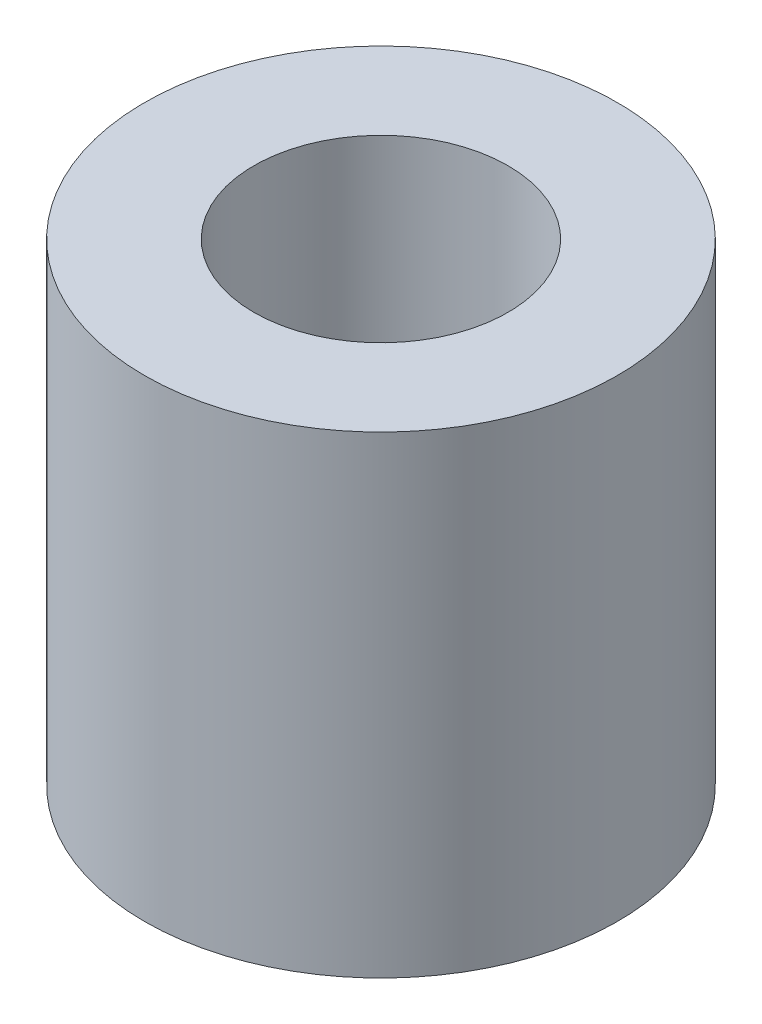
from build123d import *

# Parameters (mm, degrees)
TUBO_D8_START = -4
CROQUIS1_R    = 4
TUBO_D8_DEPTH = 8
PASO_M4_START = -4
CROQUIS2_R    = 2.15
PASO_M4_DEPTH = 8


with BuildPart() as part:
    # Croquis1 → Tubo_D8 (new body)
    with BuildSketch(Plane(origin=(0, 0, 0), x_dir=(1, 0, 0), z_dir=(0, 1, 0)).offset(TUBO_D8_START)):
        with Locations(Location((40, -195.45, 0), (0, 0, 270))):
            Circle(CROQUIS1_R)
    extrude(amount=TUBO_D8_DEPTH)

    # Croquis2 → Paso_M4 (cut)
    with BuildSketch(Plane(origin=(0, 0, 0), x_dir=(1, 0, 0), z_dir=(0, 1, 0)).offset(PASO_M4_START)):
        with Locations(Location((40, -195.45, 0), (0, 0, 270))):
            Circle(CROQUIS2_R)
    extrude(amount=PASO_M4_DEPTH, mode=Mode.SUBTRACT)


solid = part.part
